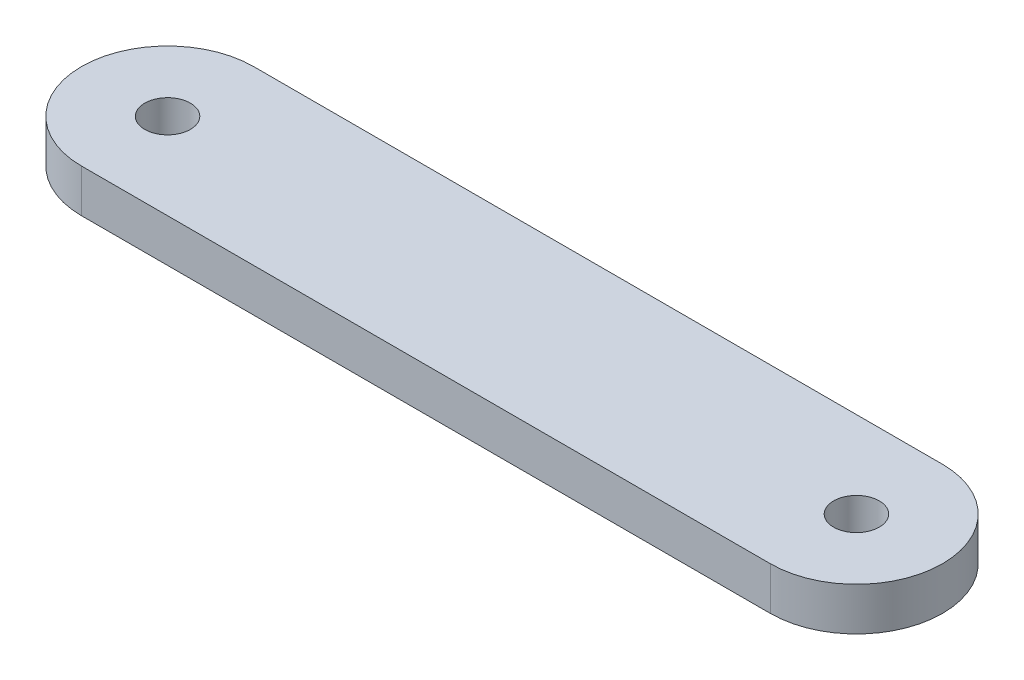
from build123d import *

# Parameters (mm, degrees)
CROQUIS1_R              = 2.65
SALIENTE_EXTRUIR1_DEPTH = 5


with BuildPart() as part:
    # Croquis1 → Saliente-Extruir1 (new body)
    with BuildSketch(Plane(origin=(0, 0, 0), x_dir=(1, 0, 0), z_dir=(0, 1, 0))):
        with BuildLine():
            Line((0, -10), (-80, -10))
            ThreePointArc((-80, -10), (-90, 0), (-80, 10))
            Line((-80, 10), (0, 10))
            ThreePointArc((0, 10), (10, 0), (0, -10))
        make_face()
        with Locations(Location((-80, 0, 0), (0, 0, 270))):
            Circle(CROQUIS1_R, mode=Mode.SUBTRACT)
        with Locations(Location((0, 0, 0), (0, 0, 270))):
            Circle(CROQUIS1_R, mode=Mode.SUBTRACT)
    extrude(amount=SALIENTE_EXTRUIR1_DEPTH)


solid = part.part
